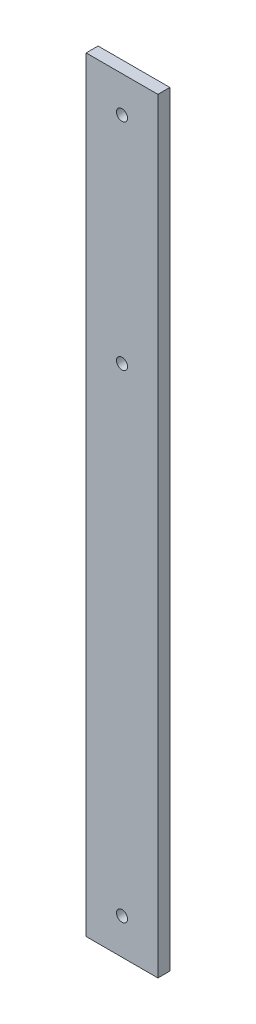
from build123d import *

# Parameters (mm, degrees)
SKETCH1_W           = 19.05
SKETCH1_H           = 203.2
BOSS_EXTRUDE1_DEPTH = 3.175
SKETCH4_R           = 1.4605
CUT_EXTRUDE1_DEPTH  = 205.115710138


with BuildPart() as part:
    # Sketch1 → Boss-Extrude1 (new body)
    with BuildSketch(Plane.XY):
        with Locations((9.525, 101.6)):
            Rectangle(SKETCH1_W, SKETCH1_H)
    extrude(amount=BOSS_EXTRUDE1_DEPTH)

    # Sketch4 → Cut-Extrude1 (cut, through all)
    with BuildSketch(Plane.XY.offset(3.175)):
        with Locations((9.525, 193.675)):
            Circle(SKETCH4_R)
        with Locations((9.525, 136.525)):
            Circle(SKETCH4_R)
        with Locations((9.525, 9.525)):
            Circle(SKETCH4_R)
    extrude(amount=-CUT_EXTRUDE1_DEPTH, mode=Mode.SUBTRACT)


solid = part.part
